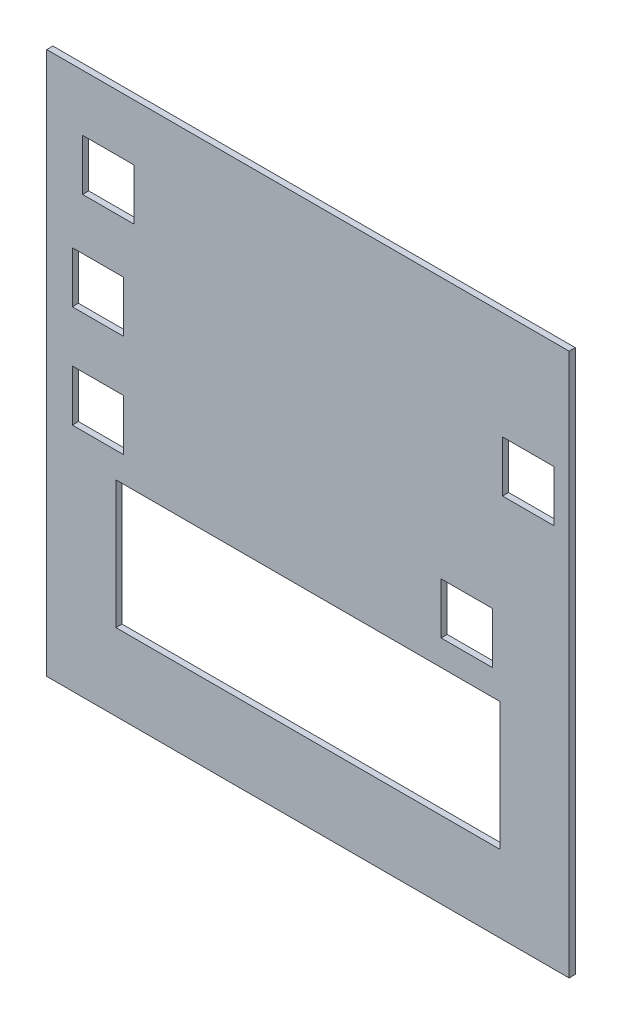
from build123d import *

# Parameters (mm, degrees)
SKETCH_1_W               = 102
SKETCH_1_H               = 106
EXTRUDE_1_DEPTH          = 1.2
CUT_EXTRUDE_2_DEPTH      = 10
CUT_EXTRUDE_2_DEPTH_BACK = 10
SKETCH_2_W               = 75
SKETCH_2_H               = 25
CUT_EXTRUDE_3_DEPTH      = 10
CUT_EXTRUDE_3_DEPTH_BACK = 10
SKETCH_3_W               = 10
SKETCH_3_H               = 10
CUT_EXTRUDE_4_DEPTH      = 10
CUT_EXTRUDE_4_DEPTH_BACK = 10
SKETCH_4_W               = 10
SKETCH_4_H               = 10


with BuildPart() as part:
    # 草图1 → 凸台-拉伸1 (new body)
    with BuildSketch(Plane.XY):
        Rectangle(SKETCH_1_W, SKETCH_1_H)
    extrude(amount=EXTRUDE_1_DEPTH)

    # 草图2 → 切除-拉伸2 (cut, two sides: drawn at the far end of the back side and taken through both)
    with BuildSketch(Plane.XY.offset(1.2).offset(-CUT_EXTRUDE_2_DEPTH_BACK)):
        with Locations((0, -25.5)):
            Rectangle(SKETCH_2_W, SKETCH_2_H)
    extrude(amount=CUT_EXTRUDE_2_DEPTH + CUT_EXTRUDE_2_DEPTH_BACK, mode=Mode.SUBTRACT)

    # 草图3 → 切除-拉伸3 (cut, two sides: drawn at the far end of the back side and taken through both)
    with BuildSketch(Plane.XY.offset(1.2).offset(-CUT_EXTRUDE_3_DEPTH_BACK)):
        with Locations((-41, -3)):
            Rectangle(SKETCH_3_W, SKETCH_3_H)
        with Locations((31, -3)):
            Rectangle(SKETCH_3_W, SKETCH_3_H)
    extrude(amount=CUT_EXTRUDE_3_DEPTH + CUT_EXTRUDE_3_DEPTH_BACK, mode=Mode.SUBTRACT)

    # 草图4 → 切除-拉伸4 (cut, two sides: drawn at the far end of the back side and taken through both)
    with BuildSketch(Plane.XY.offset(1.2).offset(-CUT_EXTRUDE_4_DEPTH_BACK)):
        with Locations((-41, 17)):
            Rectangle(SKETCH_4_W, SKETCH_4_H)
        with Locations((-39, 37)):
            Rectangle(SKETCH_4_W, SKETCH_4_H)
        with Locations((43, 27)):
            Rectangle(SKETCH_4_W, SKETCH_4_H)
    extrude(amount=CUT_EXTRUDE_4_DEPTH + CUT_EXTRUDE_4_DEPTH_BACK, mode=Mode.SUBTRACT)


solid = part.part
